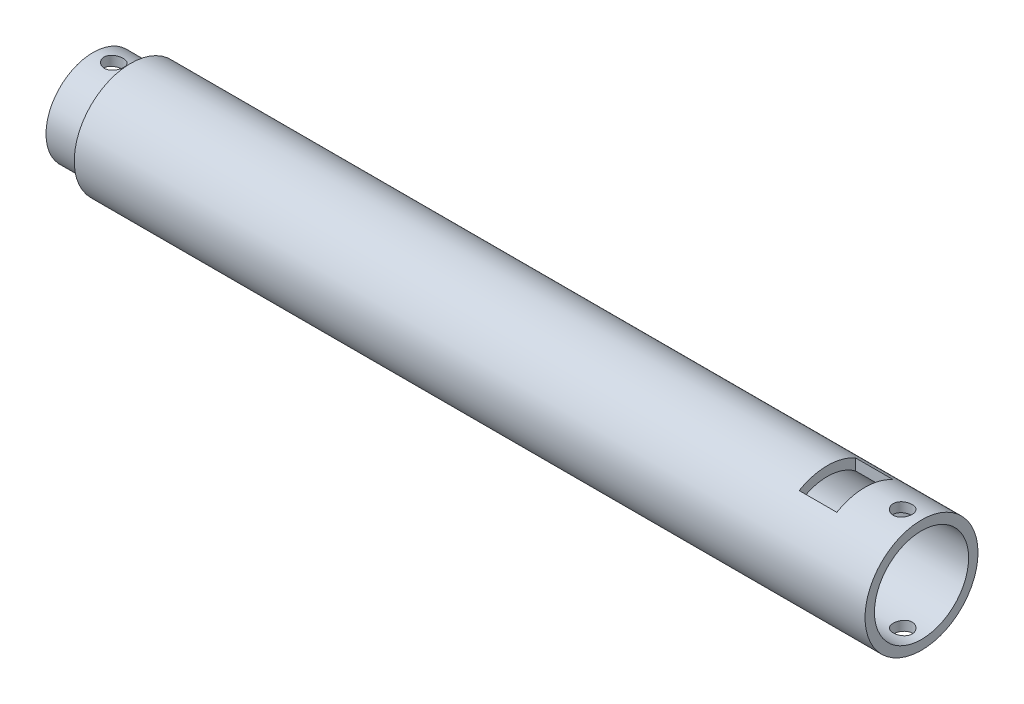
from build123d import *

# Parameters (mm, degrees)
ESBO_O1_R                  = 15
ESBO_O1_R_2                = 12.5
RESSALTO_EXTRUS_O1_DEPTH   = 210
RESSALTO_EXTRUS_O3_START   = 10
ESBO_O2_R                  = 12.5
ESBO_O2_R_2                = 10
RESSALTO_EXTRUS_O3_DEPTH   = 15
CORTE_EXTRUS_O2_DEPTH      = 300
CORTE_EXTRUS_O2_DEPTH_BACK = 300
ESBO_O4_R                  = 2.5
CORTE_EXTRUS_O3_DEPTH      = 300
CORTE_EXTRUS_O3_DEPTH_BACK = 300
ESBO_O4_3_R                = 2.5
ESBO_O6_W                  = 10
ESBO_O6_H                  = 15
CORTE_EXTRUS_O4_DEPTH      = 20


with BuildPart() as part:
    # Esboço1 → Ressalto-extrusão1 (new body)
    with BuildSketch(Plane(origin=(0, 0, 0), x_dir=(0, 0, -1), z_dir=(1, 0, 0))):
        Circle(ESBO_O1_R)
        Circle(ESBO_O1_R_2, mode=Mode.SUBTRACT)
    extrude(amount=RESSALTO_EXTRUS_O1_DEPTH)

    # Esboço2 → Ressalto-extrusão3 (add)
    with BuildSketch(Plane.ZY.offset(RESSALTO_EXTRUS_O3_START)):
        Circle(ESBO_O2_R)
        Circle(ESBO_O2_R_2, mode=Mode.SUBTRACT)
    extrude(amount=-RESSALTO_EXTRUS_O3_DEPTH)

    # Esboço4 → Corte-extrusão2 (cut, two sides: drawn at the far end of the back side and taken through both)
    with BuildSketch(Plane(origin=(0, 0, 0), x_dir=(1, 0, 0), z_dir=(0, 1, 0)).offset(-CORTE_EXTRUS_O2_DEPTH_BACK)):
        with Locations((205, 0)):
            Circle(ESBO_O4_R)
    extrude(amount=CORTE_EXTRUS_O2_DEPTH + CORTE_EXTRUS_O2_DEPTH_BACK, mode=Mode.SUBTRACT)

    # Esboço4<3> → Corte-extrusão3 (cut, two sides: drawn at the far end of the back side and taken through both)
    with BuildSketch(Plane(origin=(0, 0, 0), x_dir=(1, 0, 0), z_dir=(0, 1, 0)).offset(-CORTE_EXTRUS_O3_DEPTH_BACK)):
        with Locations((-5, 0.5)):
            Circle(ESBO_O4_3_R)
        with Locations((205, 0)):
            Circle(ESBO_O4_3_R)
    extrude(amount=CORTE_EXTRUS_O3_DEPTH + CORTE_EXTRUS_O3_DEPTH_BACK, mode=Mode.SUBTRACT)

    # Esboço6 → Corte-extrusão4 (cut)
    with BuildSketch(Plane(origin=(0, 0, 0), x_dir=(1, 0, 0), z_dir=(0, 1, 0))):
        with Locations((190, 0)):
            Rectangle(ESBO_O6_W, ESBO_O6_H)
    extrude(amount=CORTE_EXTRUS_O4_DEPTH, mode=Mode.SUBTRACT)


solid = part.part
